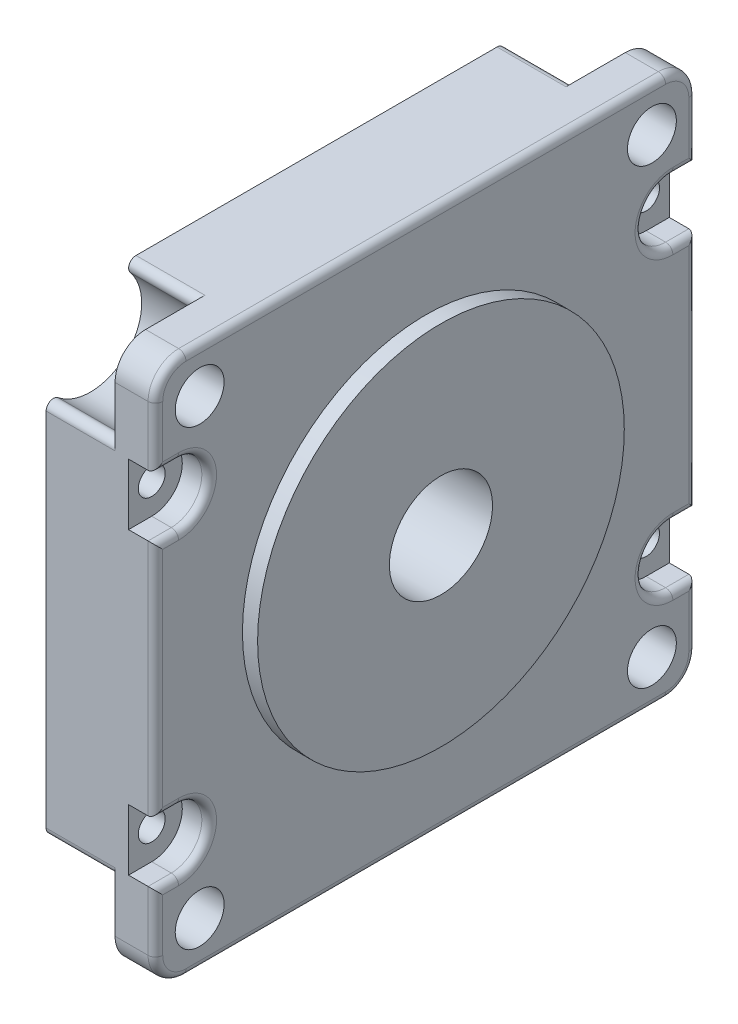
from build123d import *

# Parameters (mm, degrees)
SKETCH1_W           = 56.1848
SKETCH1_H           = 56.1848
BOSS_EXTRUDE1_DEPTH = 11.3538
SKETCH2_R           = 2.54
CUT_EXTRUDE1_DEPTH  = 42.31918017
CUT_EXTRUDE2_DEPTH  = 2.794
SKETCH4_R           = 1.397
CUT_EXTRUDE3_DEPTH  = 41.640325436
FILLET1_R           = 3.175
SKETCH5_R           = 19.05
BOSS_EXTRUDE2_DEPTH = 1.5748
SKETCH6_R           = 5.3594
CUT_EXTRUDE4_DEPTH  = 42.779355829
FILLET3_R           = 0.762
SKETCH7_R           = 5.334
CUT_EXTRUDE5_DEPTH  = 7.1628
FILLET4_R           = 0.762


with BuildPart() as part:
    # Sketch1 → Boss-Extrude1 (new body)
    with BuildSketch(Plane(origin=(0, 0, 0), x_dir=(0, 0, -1), z_dir=(1, 0, 0))):
        Rectangle(SKETCH1_W, SKETCH1_H)
    extrude(amount=BOSS_EXTRUDE1_DEPTH)

    # Sketch2 → Cut-Extrude1 (cut, through all)
    with BuildSketch(Plane(origin=(11.3538, 0, 0), x_dir=(0, 0, -1), z_dir=(1, 0, 0))):
        with Locations((-23.495, 23.495)):
            Circle(SKETCH2_R)
        with Locations(Location((23.495, 23.495, 0), (0, 0, 180))):
            Circle(SKETCH2_R)
        with Locations((23.495, -23.495)):
            Circle(SKETCH2_R)
        with Locations(Location((-23.495, -23.495, 0), (0, 0, 180))):
            Circle(SKETCH2_R)
    extrude(amount=-CUT_EXTRUDE1_DEPTH, mode=Mode.SUBTRACT)

    # Sketch3 → Cut-Extrude2 (cut)
    with BuildSketch(Plane(origin=(11.3538, 0, 0), x_dir=(0, 0, -1), z_dir=(1, 0, 0))):
        with BuildLine():
            Line((-25.6794, 18.719299782), (-28.0924, 18.719299782))
            Line((-28.0924, 18.719299782), (-28.0924, 12.369299782))
            Line((-28.0924, 12.369299782), (-25.6794, 12.369299782))
            ThreePointArc((-25.6794, 12.369299782), (-22.5044, 15.544299782), (-25.6794, 18.719299782))
        make_face()
        with BuildLine():
            Line((-28.0924, -18.719299782), (-28.0924, -12.369299782))
            Line((-28.0924, -12.369299782), (-25.6794, -12.369299782))
            ThreePointArc((-25.6794, -12.369299782), (-22.5044, -15.544299782), (-25.6794, -18.719299782))
            Line((-25.6794, -18.719299782), (-28.0924, -18.719299782))
        make_face()
        with BuildLine():
            Line((28.0924, 18.719299782), (28.0924, 12.369299782))
            Line((28.0924, 12.369299782), (25.6794, 12.369299782))
            ThreePointArc((25.6794, 12.369299782), (22.5044, 15.544299782), (25.6794, 18.719299782))
            Line((25.6794, 18.719299782), (28.0924, 18.719299782))
        make_face()
        with BuildLine():
            Line((25.6794, -18.719299782), (28.0924, -18.719299782))
            Line((28.0924, -18.719299782), (28.0924, -12.369299782))
            Line((28.0924, -12.369299782), (25.6794, -12.369299782))
            ThreePointArc((25.6794, -12.369299782), (22.5044, -15.544299782), (25.6794, -18.719299782))
        make_face()
    extrude(amount=-CUT_EXTRUDE2_DEPTH, mode=Mode.SUBTRACT)

    # Sketch4 → Cut-Extrude3 (cut, through all)
    with BuildSketch(Plane(origin=(8.5598, 0, 0), x_dir=(0, 0, -1), z_dir=(1, 0, 0))):
        with Locations((-25.6794, 15.544299782)):
            Circle(SKETCH4_R)
        with Locations(Location((25.6794, 15.544299782, 0), (0, 0, 180))):
            Circle(SKETCH4_R)
        with Locations((25.6794, -15.544299782)):
            Circle(SKETCH4_R)
        with Locations(Location((-25.6794, -15.544299782, 0), (0, 0, 180))):
            Circle(SKETCH4_R)
    extrude(amount=-CUT_EXTRUDE3_DEPTH, mode=Mode.SUBTRACT)

    # Fillet1
    fillet1_edges = [part.edges().sort_by_distance(p)[0] for p in [
        (5.6769, -28.0924, -28.0924),
        (5.6769, -28.0924, 28.0924),
        (5.6769, 28.0924, 28.0924),
        (5.6769, 28.0924, -28.0924),
    ]]
    fillet(fillet1_edges, radius=FILLET1_R)

    # Sketch5 → Boss-Extrude2 (add)
    with BuildSketch(Plane(origin=(11.3538, 0, 0), x_dir=(0, 0, -1), z_dir=(1, 0, 0))):
        with Locations(Location((0, 0, 0), (0, 0, 180))):
            Circle(SKETCH5_R)
    extrude(amount=BOSS_EXTRUDE2_DEPTH)

    # Sketch6 → Cut-Extrude4 (cut, through all)
    with BuildSketch(Plane(origin=(12.9286, 0, 0), x_dir=(0, 0, -1), z_dir=(1, 0, 0))):
        Circle(SKETCH6_R)
    extrude(amount=-CUT_EXTRUDE4_DEPTH, mode=Mode.SUBTRACT)

    # Fillet3
    fillet3_edges = [part.edges().sort_by_distance(p)[0] for p in [
        (11.3538, -28.0924, 0),
        (11.3538, 21.818349891, 28.0924),
        (11.3538, 28.0924, 0),
        (11.3538, -21.818349891, -28.0924),
        (11.3538, 27.16246403, 27.16246403),
        (11.3538, 27.16246403, -27.16246403),
        (11.3538, -27.16246403, -27.16246403),
        (11.3538, -27.16246403, 27.16246403),
        (11.3538, 0, 28.0924),
        (11.3538, 15.544299782, 22.5044),
        (11.3538, 18.719299782, 26.8859),
        (11.3538, 12.369299782, 26.8859),
        (11.3538, -21.818349891, 28.0924),
        (11.3538, 0, -28.0924),
        (11.3538, 21.818349891, -28.0924),
        (11.3538, 15.544299782, -22.5044),
        (11.3538, 12.369299782, -26.8859),
        (11.3538, 18.719299782, -26.8859),
        (11.3538, -15.544299782, 22.5044),
        (11.3538, -12.369299782, 26.8859),
        (11.3538, -18.719299782, 26.8859),
        (11.3538, -15.544299782, -22.5044),
        (11.3538, -18.719299782, -26.8859),
        (11.3538, -12.369299782, -26.8859),
    ]]
    fillet(fillet3_edges, radius=FILLET3_R)

    # Sketch7 → Cut-Extrude5 (cut)
    with BuildSketch(Plane.ZY):
        with Locations((-23.495, 23.495)):
            Circle(SKETCH7_R)
        with Locations((23.495, 23.495)):
            Circle(SKETCH7_R)
        with Locations((23.495, -23.495)):
            Circle(SKETCH7_R)
        with Locations((-23.495, -23.495)):
            Circle(SKETCH7_R)
    extrude(amount=-CUT_EXTRUDE5_DEPTH, mode=Mode.SUBTRACT)

    # Fillet4
    fillet4_edges = [part.edges().sort_by_distance(p)[0] for p in [
        (3.5814, 20.790287586, -28.0924),
        (3.5814, 28.0924, -20.790287586),
        (3.5814, 28.0924, 20.790287586),
        (3.5814, 20.790287586, 28.0924),
        (3.5814, -20.790287586, 28.0924),
        (3.5814, -28.0924, 20.790287586),
        (3.5814, -20.790287586, -28.0924),
        (3.5814, -28.0924, -20.790287586),
    ]]
    fillet(fillet4_edges, radius=FILLET4_R)


solid = part.part
